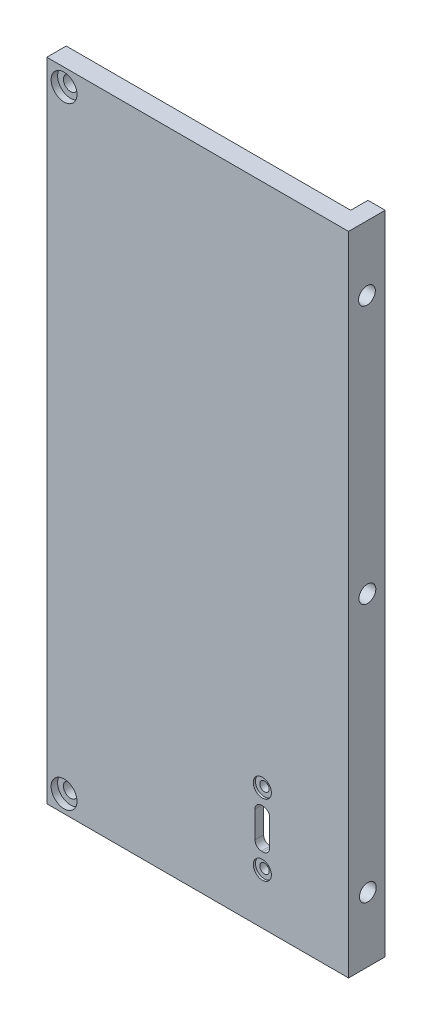
from build123d import *

# Parameters (mm, degrees)
SKETCH1_W           = 150
SKETCH1_H           = 70
BOSS_EXTRUDE1_DEPTH = 4.5
SKETCH7_W           = 4
SKETCH7_H           = 150
BOSS_EXTRUDE2_DEPTH = 4
SKETCH8_R           = 1.95
CUT_EXTRUDE5_DEPTH  = 10
SKETCH9_R           = 1.65
CUT_EXTRUDE6_DEPTH  = 166.747549001
SKETCH10_R          = 3
CUT_EXTRUDE7_DEPTH  = 1.5
SKETCH13_R          = 2.1
CUT_EXTRUDE10_DEPTH = 0.5
SKETCH14_R          = 1.1
SKETCH14_W          = 3.4
SKETCH14_H          = 9.2
CUT_EXTRUDE11_DEPTH = 166.747549001
FILLET3_R           = 1.5
SKETCH15_W          = 12
SKETCH15_H          = 27
CUT_EXTRUDE12_DEPTH = 2.5
FILLET4_R           = 4


with BuildPart() as part:
    # Sketch1 → Boss-Extrude1 (new body)
    with BuildSketch(Plane(origin=(0, 0, 0), x_dir=(0, 1, 0), z_dir=(0, 0, 1))):
        with Locations((75, 35)):
            Rectangle(SKETCH1_W, SKETCH1_H)
    extrude(amount=BOSS_EXTRUDE1_DEPTH)

    # Sketch7 → Boss-Extrude2 (add)
    with BuildSketch(Plane(origin=(0, 0, 0), x_dir=(1, 0, 0), z_dir=(0, 0, -1))):
        with Locations((-2, -75)):
            Rectangle(SKETCH7_W, SKETCH7_H)
    extrude(amount=BOSS_EXTRUDE2_DEPTH)

    # Sketch8 → Cut-Extrude5 (cut)
    with BuildSketch(Plane.YZ):
        with Locations(Location((15, 0.025, 0), (0, 0, 270))):
            Circle(SKETCH8_R)
        with Locations(Location((75, 0.125, 0), (0, 0, 270))):
            Circle(SKETCH8_R)
        with Locations(Location((135, 0.225, 0), (0, 0, 270))):
            Circle(SKETCH8_R)
    extrude(amount=-CUT_EXTRUDE5_DEPTH, mode=Mode.SUBTRACT)

    # Sketch9 → Cut-Extrude6 (cut, through all)
    with BuildSketch(Plane.XY.offset(4.5)):
        with Locations((-66, 146)):
            Circle(SKETCH9_R)
        with Locations((-66, 4)):
            Circle(SKETCH9_R)
    extrude(amount=-CUT_EXTRUDE6_DEPTH, mode=Mode.SUBTRACT)

    # Sketch10 → Cut-Extrude7 (cut)
    with BuildSketch(Plane.XY.offset(4.5)):
        with Locations((-66, 146)):
            Circle(SKETCH10_R)
        with Locations((-66, 4)):
            Circle(SKETCH10_R)
    extrude(amount=-CUT_EXTRUDE7_DEPTH, mode=Mode.SUBTRACT)

    # Sketch13 → Cut-Extrude10 (cut)
    with BuildSketch(Plane.XY.offset(4.5)):
        with Locations((-20, 28.25)):
            Circle(SKETCH13_R)
        with Locations((-20, 11.75)):
            Circle(SKETCH13_R)
    extrude(amount=-CUT_EXTRUDE10_DEPTH, mode=Mode.SUBTRACT)

    # Sketch14 → Cut-Extrude11 (cut, through all)
    with BuildSketch(Plane.XY.offset(4.5)):
        with Locations((-20, 11.75)):
            Circle(SKETCH14_R)
        with Locations((-20, 28.25)):
            Circle(SKETCH14_R)
        with Locations((-20, 20)):
            Rectangle(SKETCH14_W, SKETCH14_H)
    extrude(amount=-CUT_EXTRUDE11_DEPTH, mode=Mode.SUBTRACT)

    # Fillet3
    fillet3_edges = [part.edges().sort_by_distance(p)[0] for p in [
        (-18.3, 24.6, 2.25),
        (-18.3, 15.4, 2.25),
        (-21.7, 15.4, 2.25),
        (-21.7, 24.6, 2.25),
    ]]
    fillet(fillet3_edges, radius=FILLET3_R)

    # Sketch15 → Cut-Extrude12 (cut)
    with BuildSketch(Plane(origin=(0, 0, 0), x_dir=(1, 0, 0), z_dir=(0, 0, -1))):
        with Locations((-20, -20)):
            Rectangle(SKETCH15_W, SKETCH15_H)
    extrude(amount=-CUT_EXTRUDE12_DEPTH, mode=Mode.SUBTRACT)

    # Fillet4
    fillet4_edges = [part.edges().sort_by_distance(p)[0] for p in [
        (-14, 6.5, 1.25),
        (-14, 33.5, 1.25),
        (-26, 33.5, 1.25),
        (-26, 6.5, 1.25),
    ]]
    fillet(fillet4_edges, radius=FILLET4_R)


solid = part.part
